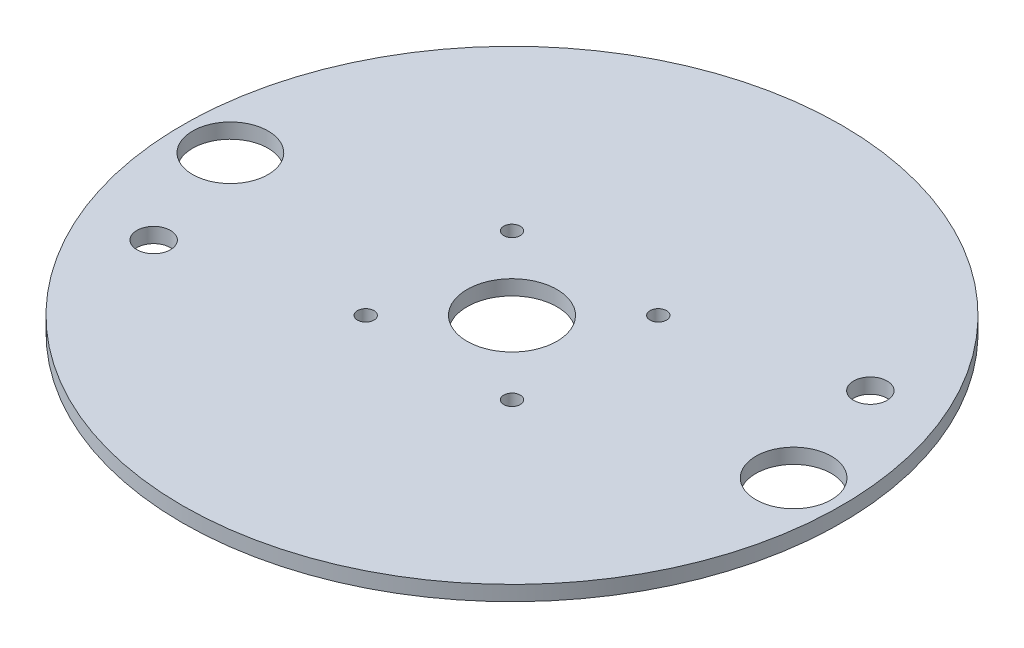
from build123d import *

# Parameters (mm, degrees)
SKETCH1_R           = 69.85
SKETCH1_R_2         = 9.525
BOSS_EXTRUDE1_DEPTH = 3.175
SKETCH2_R           = 8.001
SKETCH2_R_2         = 3.556
CUT_EXTRUDE1_DEPTH  = 3.175
SKETCH3_R           = 1.750000056
SKETCH3_R_2         = 1.75
CUT_EXTRUDE2_DEPTH  = 50.8


with BuildPart() as part:
    # Sketch1 → Boss-Extrude1 (new body)
    with BuildSketch(Plane(origin=(0, 0, 0), x_dir=(1, 0, 0), z_dir=(0, 1, 0))):
        with Locations(Location((0, 0, 0), (0, 0, 270))):
            Circle(SKETCH1_R)
        with Locations(Location((0, 0, 0), (0, 0, 270))):
            Circle(SKETCH1_R_2, mode=Mode.SUBTRACT)
    extrude(amount=BOSS_EXTRUDE1_DEPTH)

    # Sketch2 → Cut-Extrude1 (cut)
    with BuildSketch(Plane(origin=(0, 3.175, 0), x_dir=(1, 0, 0), z_dir=(0, 1, 0))):
        with Locations(Location((-59.69, 0, 0), (0, 0, 270))):
            Circle(SKETCH2_R)
        with Locations(Location((59.69, 0, 0), (0, 0, 270))):
            Circle(SKETCH2_R)
        with Locations(Location((-51.795490029, -24.152633658, 0), (0, 0, 270))):
            Circle(SKETCH2_R_2)
        with Locations(Location((51.795490029, 24.152633658, 0), (0, 0, 270))):
            Circle(SKETCH2_R_2)
    extrude(amount=-CUT_EXTRUDE1_DEPTH, mode=Mode.SUBTRACT)

    # Sketch3 → Cut-Extrude2 (cut)
    with BuildSketch(Plane(origin=(0, 3.175, 0), x_dir=(1, 0, 0), z_dir=(0, 1, 0))):
        with Locations(Location((15.5, 15.5, 0), (0, 0, 270))):
            Circle(SKETCH3_R)
        with Locations(Location((15.5, -15.5, 0), (0, 0, 270))):
            Circle(SKETCH3_R)
        with Locations(Location((-15.5, -15.5, 0), (0, 0, 270))):
            Circle(SKETCH3_R)
        with Locations(Location((-15.5, 15.5, 0), (0, 0, 270))):
            Circle(SKETCH3_R_2)
    extrude(amount=-CUT_EXTRUDE2_DEPTH, mode=Mode.SUBTRACT)


solid = part.part
